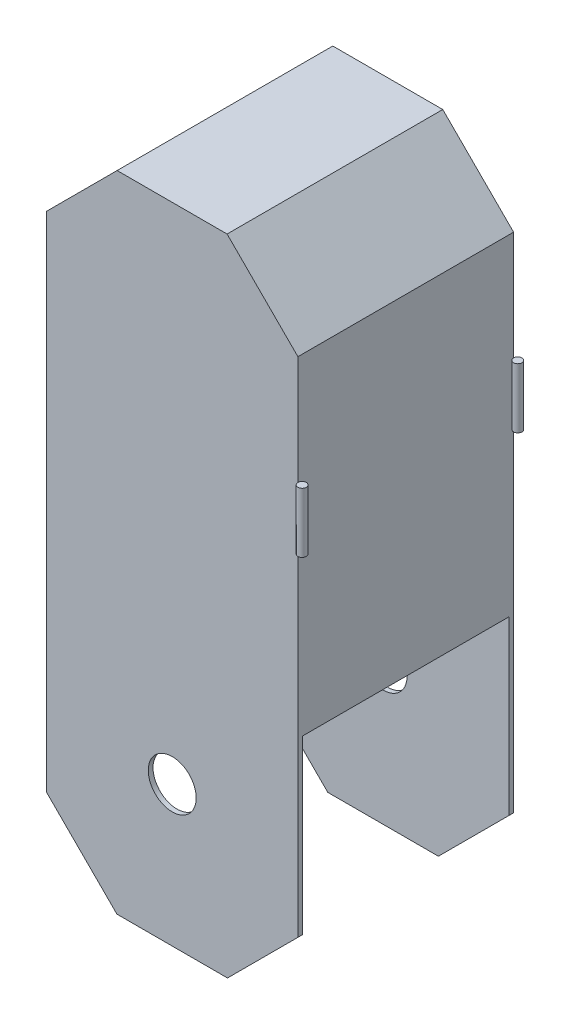
from build123d import *

# Parameters (mm, degrees)
EXTRUDE_1_DEPTH       = 180
SKETCH1_W             = 172
SKETCH1_H             = 208.862338185
CUT_EXTRUDE1_DEPTH    = 698.966972306
SKETCH2_R             = 20
CUT_EXTRUDE2_DEPTH    = 674.869657154
SKETCH3_R             = 3.5
BOSS_EXTRUDE1_DEPTH   = 50
BOSS_EXTRUDE1_2_DEPTH = 50


with BuildPart() as part:
    # Эскиз1 → Вытянуть1 (new body)
    with BuildSketch(Plane.XY):
        Polygon((105.082921559, 581.722068254), (45.979042749, 640.825947064), (-45.813199631, 640.825947064), (-104.917078441, 581.722068254), (-104.917078441, 162.212880509), (-45.97317451, 103.268976578), (46.326817337, 103.268976578), (105.082921559, 162.0250808), align=None)
    extrude(amount=EXTRUDE_1_DEPTH)

    # Sketch1 → Cut-Extrude1 (cut, through all)
    with BuildSketch(Plane(origin=(105.082921559, 0, 0), x_dir=(0, 0, -1), z_dir=(1, 0, 0))):
        with Locations((-90, 201.194997681)):
            Rectangle(SKETCH1_W, SKETCH1_H)
    extrude(amount=-CUT_EXTRUDE1_DEPTH, mode=Mode.SUBTRACT)

    # Sketch2 → Cut-Extrude2 (cut, through all)
    with BuildSketch(Plane(origin=(0, 0, 0), x_dir=(-1, 0, 0), z_dir=(0, 0, -1))):
        with Locations((-0.176821413, 220.268976578)):
            Circle(SKETCH2_R)
    extrude(amount=-CUT_EXTRUDE2_DEPTH, mode=Mode.SUBTRACT)


with BuildPart() as body_2:
    # Sketch3 → Boss-Extrude1 (new body)
    with BuildSketch(Plane(origin=(0, 440.825947064, 0), x_dir=(1, 0, 0), z_dir=(0, 1, 0))):
        with Locations(Location((108.582921559, 0, 0), (0, 0, 180))):
            Circle(SKETCH3_R)
    extrude(amount=BOSS_EXTRUDE1_DEPTH)


with BuildPart() as body_3:
    # Sketch3 → Boss-Extrude1 2 (new body)
    with BuildSketch(Plane(origin=(0, 440.825947064, 0), x_dir=(1, 0, 0), z_dir=(0, 1, 0))):
        with Locations((108.582921559, -180)):
            Circle(SKETCH3_R)
    extrude(amount=BOSS_EXTRUDE1_2_DEPTH)


solid = Compound([part.part, body_2.part, body_3.part])
